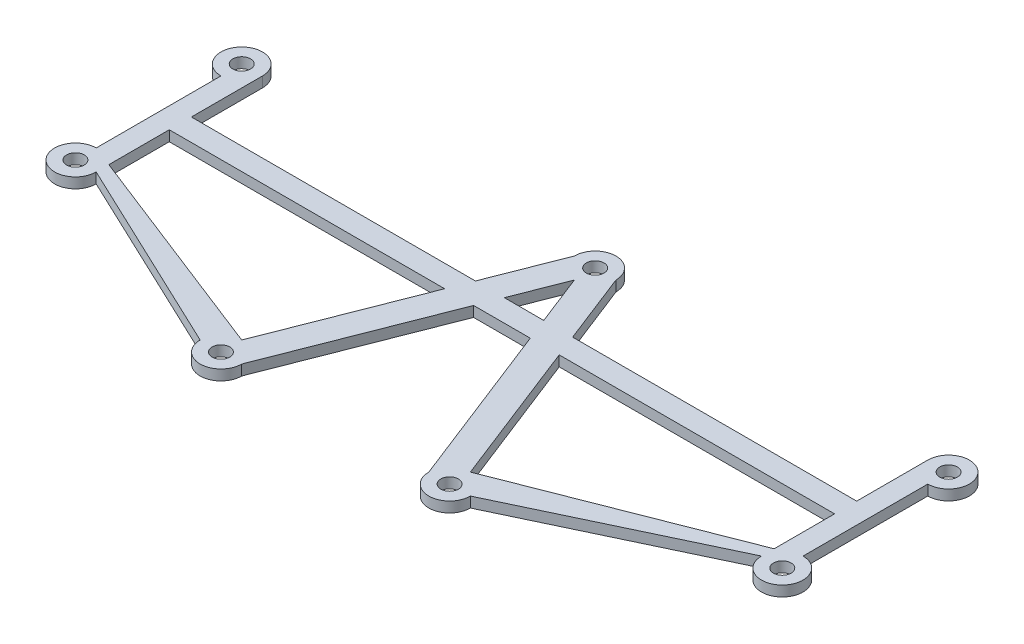
from build123d import *

# Parameters (mm, degrees)
SKETCH1_R           = 1.7
BOSS_EXTRUDE2_DEPTH = 2


with BuildPart() as part:
    # Sketch1 → Boss-Extrude2 (new body)
    with BuildSketch(Plane.XZ.offset(3.574146791)):
        with BuildLine():
            Line((-152.723385358, 44.700516394), (-152.723385358, 20.700516394))
            ThreePointArc((-152.723385358, 20.700516394), (-155.551812483, 13.872089269), (-148.723385358, 16.700516394))
            Line((-148.723385358, 16.700516394), (-148.723385358, 30.384571347))
            Line((-148.723385358, 30.384571347), (-94.078015557, 30.384571347))
            Line((-94.078015557, 30.384571347), (-88.723385358, 16.700516394))
            ThreePointArc((-88.723385358, 16.700516394), (-84.723385358, 12.700516394), (-80.723385358, 16.700516394))
            Line((-80.723385358, 16.700516394), (-75.368755159, 30.384571347))
            Line((-75.368755159, 30.384571347), (-20.723385358, 30.384571347))
            Line((-20.723385358, 30.384571347), (-20.723385358, 16.700516394))
            ThreePointArc((-20.723385358, 16.700516394), (-13.894958233, 13.872089269), (-16.723385358, 20.700516394))
            Line((-16.723385358, 20.700516394), (-16.723385358, 44.700516394))
            ThreePointArc((-16.723385358, 44.700516394), (-13.894958233, 51.528943519), (-20.723385358, 48.700516394))
            Line((-20.723385358, 48.700516394), (-58.723385358, 66.700516394))
            ThreePointArc((-58.723385358, 66.700516394), (-62.723385358, 70.700516394), (-66.723385358, 66.700516394))
            Line((-66.723385358, 66.700516394), (-79.270108033, 34.636669558))
            Line((-79.270108033, 34.636669558), (-90.176662683, 34.636669558))
            Line((-90.176662683, 34.636669558), (-102.723385358, 66.700516394))
            ThreePointArc((-102.723385358, 66.700516394), (-106.723385358, 70.700516394), (-110.723385358, 66.700516394))
            Line((-110.723385358, 66.700516394), (-148.723385358, 48.700516394))
            ThreePointArc((-148.723385358, 48.700516394), (-155.551812483, 51.528943519), (-152.723385358, 44.700516394))
        make_face()
        with Locations(Location((-152.723385358, 48.700516394, 0), (0, 0, 270))):
            Circle(SKETCH1_R, mode=Mode.SUBTRACT)
        with Locations(Location((-106.723385358, 66.700516394, 0), (0, 0, 270))):
            Circle(SKETCH1_R, mode=Mode.SUBTRACT)
        with Locations(Location((-62.723385358, 66.700516394, 0), (0, 0, 270))):
            Circle(SKETCH1_R, mode=Mode.SUBTRACT)
        with Locations(Location((-16.723385358, 48.700516394, 0), (0, 0, 270))):
            Circle(SKETCH1_R, mode=Mode.SUBTRACT)
        with Locations(Location((-152.723385358, 16.700516394, 0), (0, 0, 270))):
            Circle(SKETCH1_R, mode=Mode.SUBTRACT)
        with Locations(Location((-84.723385358, 16.700516394, 0), (0, 0, 270))):
            Circle(SKETCH1_R, mode=Mode.SUBTRACT)
        with Locations(Location((-16.723385358, 16.700516394, 0), (0, 0, 270))):
            Circle(SKETCH1_R, mode=Mode.SUBTRACT)
        Polygon((-148.723385358, 46.265733785), (-148.723385358, 34.636669558), (-95.741880075, 34.636669558), (-106.723385358, 62.700516394), align=None, mode=Mode.SUBTRACT)
        Polygon((-84.723385358, 20.700516394), (-80.933972551, 30.384571347), (-88.512798166, 30.384571347), align=None, mode=Mode.SUBTRACT)
        Polygon((-62.723385358, 62.700516394), (-73.704890642, 34.636669558), (-20.723385358, 34.636669558), (-20.723385358, 46.265733785), align=None, mode=Mode.SUBTRACT)
    extrude(amount=BOSS_EXTRUDE2_DEPTH)


solid = part.part
